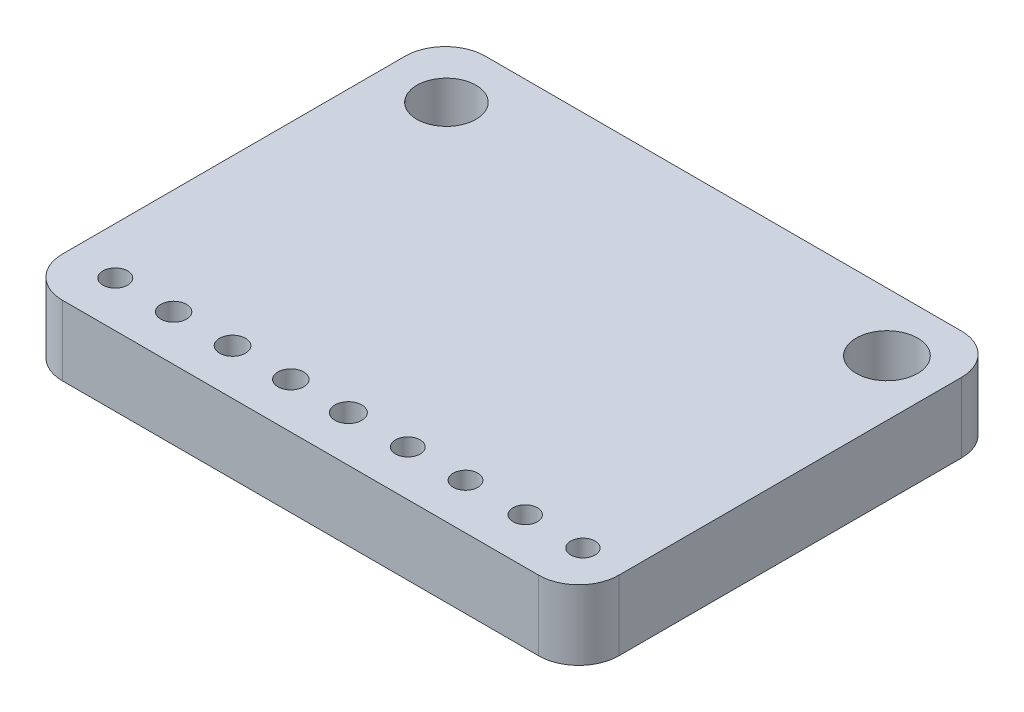
from build123d import *

# Parameters (mm, degrees)
SKETCH1_W           = 25
SKETCH1_H           = 19
BOSS_EXTRUDE1_DEPTH = 3.14
SKETCH2_R           = 1.328703157
CUT_EXTRUDE1_DEPTH  = 32.557243226
SKETCH3_R           = 1.379079597
CUT_EXTRUDE2_DEPTH  = 32.557243226
SKETCH4_R           = 0.546420727
SKETCH4_R_2         = 0.547156774
SKETCH4_R_3         = 0.553895188
SKETCH4_R_4         = 0.554442322
SKETCH4_R_5         = 0.60258245
SKETCH4_R_6         = 0.580608074
SKETCH4_R_7         = 0.583065552
SKETCH4_R_8         = 0.578153998
SKETCH4_R_9         = 0.55656492
CUT_EXTRUDE3_DEPTH  = 32.557243226
FILLET1_R           = 1.8


with BuildPart() as part:
    # Sketch1 → Boss-Extrude1 (new body)
    with BuildSketch(Plane(origin=(0, 0, 0), x_dir=(1, 0, 0), z_dir=(0, 1, 0))):
        with Locations((12.5, 9.5)):
            Rectangle(SKETCH1_W, SKETCH1_H)
    extrude(amount=BOSS_EXTRUDE1_DEPTH)

    # Sketch2 → Cut-Extrude1 (cut, through all)
    with BuildSketch(Plane(origin=(0, 3.14, 0), x_dir=(1, 0, 0), z_dir=(0, 1, 0))):
        with Locations(Location((2.722594634, 16.331436322, 0), (0, 0, 270))):
            Circle(SKETCH2_R)
    extrude(amount=-CUT_EXTRUDE1_DEPTH, mode=Mode.SUBTRACT)

    # Sketch3 → Cut-Extrude2 (cut, through all)
    with BuildSketch(Plane(origin=(0, 3.14, 0), x_dir=(1, 0, 0), z_dir=(0, 1, 0))):
        with Locations(Location((22.483739106, 16.364797794, 0), (0, 0, 270))):
            Circle(SKETCH3_R)
    extrude(amount=-CUT_EXTRUDE2_DEPTH, mode=Mode.SUBTRACT)

    # Sketch4 → Cut-Extrude3 (cut, through all)
    with BuildSketch(Plane(origin=(0, 3.14, 0), x_dir=(1, 0, 0), z_dir=(0, 1, 0))):
        with Locations(Location((23.137145161, 2.05046074, 0), (0, 0, 270))):
            Circle(SKETCH4_R)
        with Locations(Location((20.543630063, 2.05046074, 0), (0, 0, 270))):
            Circle(SKETCH4_R_2)
        with Locations(Location((17.860899334, 2.05046074, 0), (0, 0, 270))):
            Circle(SKETCH4_R_3)
        with Locations(Location((15.268099294, 2.05046074, 0), (0, 0, 270))):
            Circle(SKETCH4_R_4)
        with Locations(Location((12.597553851, 2.05046074, 0), (0, 0, 270))):
            Circle(SKETCH4_R_5)
        with Locations(Location((10.010026119, 2.05046074, 0), (0, 0, 270))):
            Circle(SKETCH4_R_6)
        with Locations(Location((7.390364783, 2.05046074, 0), (0, 0, 270))):
            Circle(SKETCH4_R_7)
        with Locations(Location((4.744820308, 2.05046074, 0), (0, 0, 270))):
            Circle(SKETCH4_R_8)
        with Locations(Location((2.121365988, 2.05046074, 0), (0, 0, 270))):
            Circle(SKETCH4_R_9)
    extrude(amount=-CUT_EXTRUDE3_DEPTH, mode=Mode.SUBTRACT)

    # Fillet1
    fillet1_edges = [part.edges().sort_by_distance(p)[0] for p in [
        (0, 1.57, -19),
        (25, 1.57, -19),
        (25, 1.57, 0),
        (0, 1.57, 0),
    ]]
    fillet(fillet1_edges, radius=FILLET1_R)


solid = part.part
